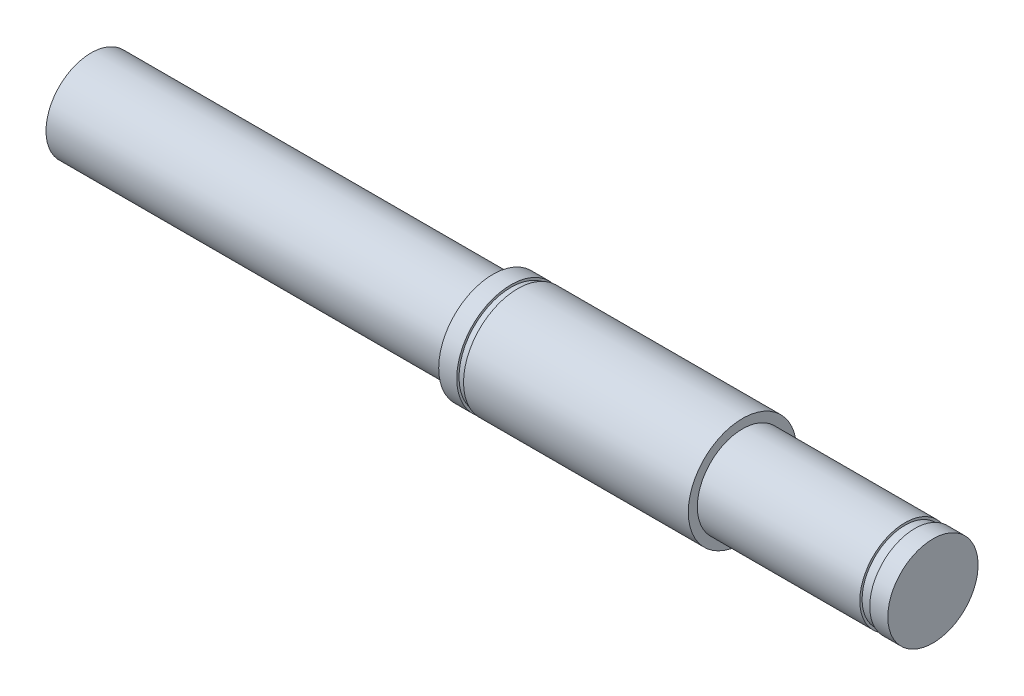
from build123d import *


with BuildPart() as part:
    # Sketch2 → Revolve1 (revolve)
    with BuildSketch(Plane.XY, mode=Mode.PRIVATE) as revolve1_sk:
        Polygon((-46.5, 0), (-46.5, 5), (-2, 5), (-2, 6), (0, 6), (0, 5.75), (0.75, 5.75), (0.75, 6), (25.65, 6), (25.65, 5), (43.65, 5), (43.65, 4.75), (44.75, 4.75), (44.75, 5), (46.75, 5), (46.75, 0), align=None)
    revolve(revolve1_sk.sketch.rotate(Axis((-46.5, 0, 0), (1, 0, 0)), 90), axis=Axis((-46.5, 0, 0), (1, 0, 0)))


solid = part.part
